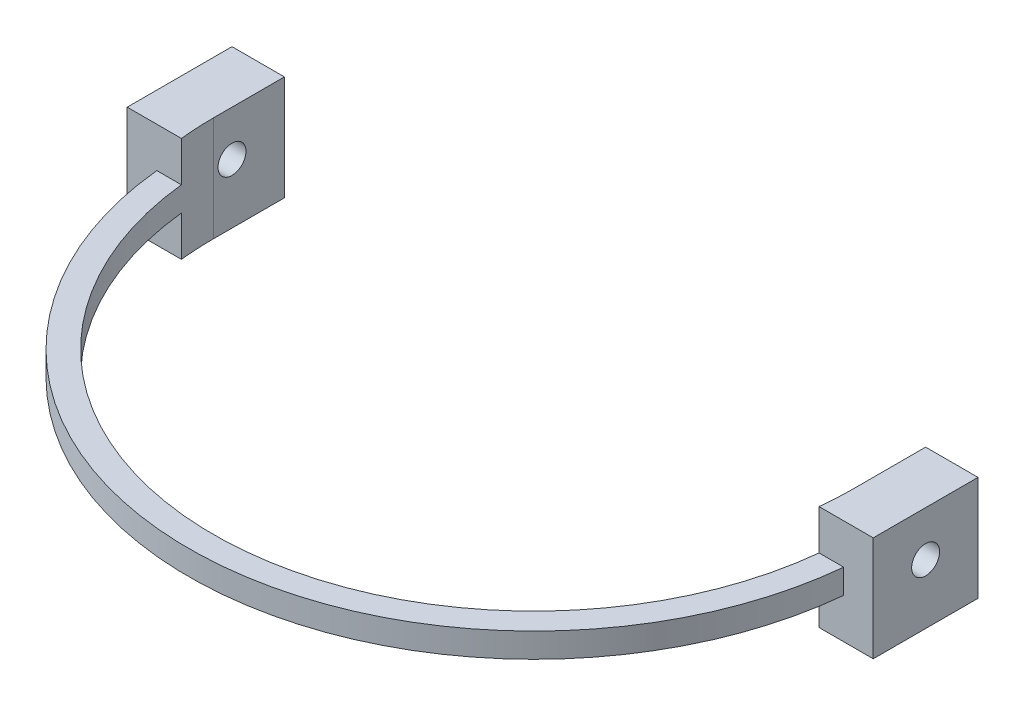
from build123d import *

# Parameters (mm, degrees)
BOSS_EXTRUDE1_DEPTH      = 60
CUT_EXTRUDE19_DEPTH      = 171.881965709
CUT_EXTRUDE19_DEPTH_BACK = 171.881965709
SKETCH30_W               = 213.61
SKETCH30_H               = 30
SKETCH31_R               = 4
CUT_EXTRUDE20_DEPTH      = 243.881988062
CUT_EXTRUDE21_DEPTH      = 11.5
CUT_EXTRUDE22_START      = -11.5
CUT_EXTRUDE22_DEPTH      = 11.5


with BuildPart() as part:
    # Sketch1 → Boss-Extrude1 (new body)
    with BuildSketch(Plane(origin=(0, 0, 0), x_dir=(1, 0, 0), z_dir=(0, 1, 0))):
        with BuildLine():
            Line((106.805, -9.669202779), (98.330740578, -9.669202779))
            ThreePointArc((98.330740578, -9.669202779), (0, -98.805), (-98.330740578, -9.669202779))
            Line((-98.330740578, -9.669202779), (-106.805, -9.669202779))
            Line((-106.805, -9.669202779), (-106.805, 20.330797221))
            Line((-106.805, 20.330797221), (-91.805, 20.330797221))
            Line((-91.805, 20.330797221), (-91.805, 0))
            ThreePointArc((-91.805, 0), (0, -91.805), (91.805, 0))
            Line((91.805, 0), (91.805, 20.330797221))
            Line((91.805, 20.330797221), (106.805, 20.330797221))
            Line((106.805, 20.330797221), (106.805, -9.669202779))
        make_face()
    extrude(amount=-BOSS_EXTRUDE1_DEPTH)

    # Sketch30 → Cut-Extrude19 (cut, two sides: drawn at the far end of the back side and taken through both)
    with BuildSketch(Plane(origin=(0, 0, -20.330797221), x_dir=(-1, 0, 0), z_dir=(0, 0, -1)).offset(-CUT_EXTRUDE19_DEPTH_BACK)):
        with Locations((0, -15)):
            Rectangle(SKETCH30_W, SKETCH30_H)
    extrude(amount=CUT_EXTRUDE19_DEPTH + CUT_EXTRUDE19_DEPTH_BACK, mode=Mode.SUBTRACT)

    # Sketch31 → Cut-Extrude20 (cut, through all)
    with BuildSketch(Plane(origin=(106.805, 0, 0), x_dir=(0, 0, -1), z_dir=(1, 0, 0))):
        with Locations((5.330797221, -42.92674227)):
            Circle(SKETCH31_R)
    extrude(amount=-CUT_EXTRUDE20_DEPTH, mode=Mode.SUBTRACT)

    # Sketch32 → Cut-Extrude21 (cut)
    with BuildSketch(Plane(origin=(0, -30, 0), x_dir=(1, 0, 0), z_dir=(0, 1, 0))):
        with BuildLine():
            Line((98.330740578, -9.669202779), (-98.330740578, -9.669202779))
            ThreePointArc((-98.330740578, -9.669202779), (0, -98.805), (98.330740578, -9.669202779))
        make_face()
    extrude(amount=-CUT_EXTRUDE21_DEPTH, mode=Mode.SUBTRACT)

    # Sketch33 → Cut-Extrude22 (cut)
    with BuildSketch(Plane(origin=(0, -60, 0), x_dir=(-1, 0, 0), z_dir=(0, -1, 0)).offset(CUT_EXTRUDE22_START)):
        with BuildLine():
            Line((98.330740578, -9.669202779), (-98.330740578, -9.669202779))
            ThreePointArc((-98.330740578, -9.669202779), (0, -98.805), (98.330740578, -9.669202779))
        make_face()
    extrude(amount=CUT_EXTRUDE22_DEPTH, mode=Mode.SUBTRACT)


solid = part.part
